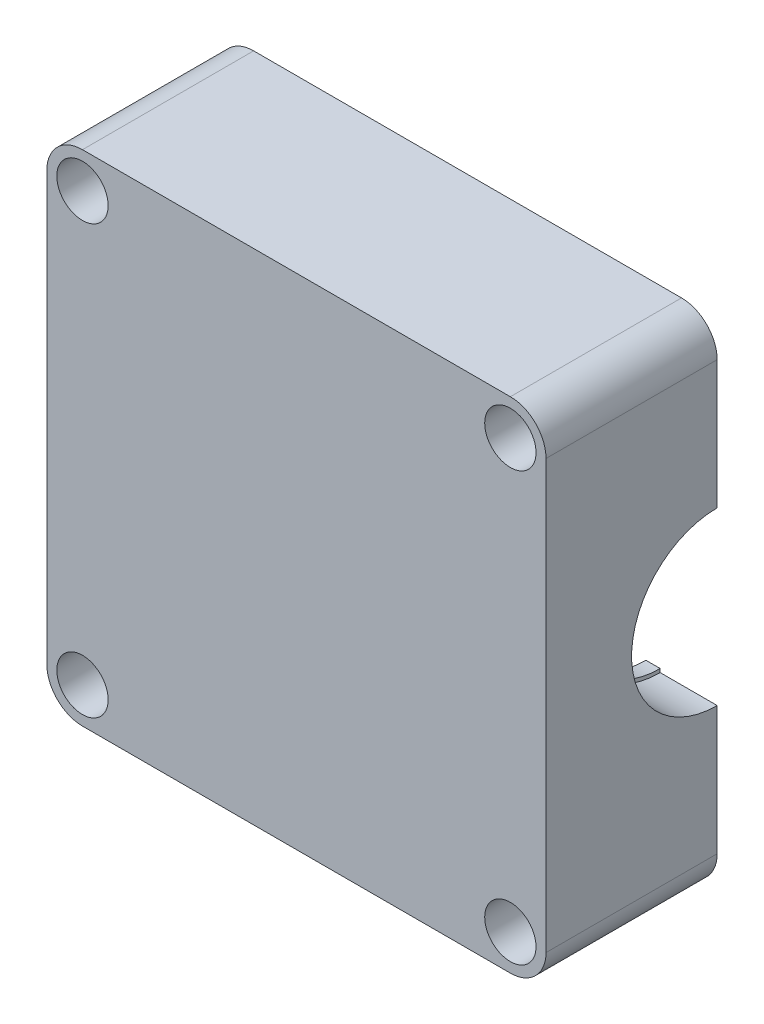
from build123d import *

# Parameters (mm, degrees)
SKETCH_1_R          = 1.8
EXTRUDE_1_DEPTH     = 42
SKETCH_2_R          = 6
CUT_EXTRUDE_1_DEPTH = 58.404268134
SKETCH_3_R          = 6
CUT_EXTRUDE_2_DEPTH = 58.404268134
CUT_EXTRUDE_3_DEPTH = 58.404268134
EXTRUDE_2_DEPTH     = 2.1
EXTRUDE_3_DEPTH     = 1
EXTRUDE_START       = -2
EXTRUDE_4_DEPTH     = 2


with BuildPart() as part:
    # 草图1 → 凸台-拉伸1 (new body)
    with BuildSketch(Plane(origin=(0, 0, 0), x_dir=(-1, 0, 0), z_dir=(0, 0, 1))):
        with BuildLine():
            Line((-17.5, 15), (-17.5, -15))
            ThreePointArc((-17.5, -15), (-16.767766953, -16.767766953), (-15, -17.5))
            Line((-15, -17.5), (15, -17.5))
            ThreePointArc((15, -17.5), (16.767766953, -16.767766953), (17.5, -15))
            Line((17.5, -15), (17.5, 15))
            ThreePointArc((17.5, 15), (16.767766953, 16.767766953), (15, 17.5))
            Line((15, 17.5), (-15, 17.5))
            ThreePointArc((-15, 17.5), (-16.767766953, 16.767766953), (-17.5, 15))
        make_face()
        with Locations((-15, -15)):
            Circle(SKETCH_1_R, mode=Mode.SUBTRACT)
        with Locations((15, -15)):
            Circle(SKETCH_1_R, mode=Mode.SUBTRACT)
        with Locations((15, 15)):
            Circle(SKETCH_1_R, mode=Mode.SUBTRACT)
        with Locations((-15, 15)):
            Circle(SKETCH_1_R, mode=Mode.SUBTRACT)
        with BuildLine():
            Line((15.604722414, -11.417049415), (15.604722414, 11.417049415))
            ThreePointArc((15.604722414, 11.417049415), (15.349600754, 12.084241863), (14.71440494, 12.410981979))
            ThreePointArc((14.71440494, 12.410981979), (13.158183899, 13.158182338), (12.410982221, 14.714402746))
            ThreePointArc((12.410982221, 14.714402746), (12.084242685, 15.349600017), (11.417049415, 15.604722414))
            Line((11.417049415, 15.604722414), (-11.417049415, 15.604722414))
            ThreePointArc((-11.417049415, 15.604722414), (-12.084241863, 15.349600754), (-12.410981979, 14.71440494))
            ThreePointArc((-12.410981979, 14.71440494), (-13.158182338, 13.158183899), (-14.714402746, 12.410982221))
            ThreePointArc((-14.714402746, 12.410982221), (-15.349600017, 12.084242685), (-15.604722413, 11.417049415))
            Line((-15.604722413, 11.417049415), (-15.604722413, -11.417049415))
            ThreePointArc((-15.604722413, -11.417049415), (-15.349600754, -12.084241863), (-14.71440494, -12.410981979))
            ThreePointArc((-14.71440494, -12.410981979), (-13.158183899, -13.158182338), (-12.410982221, -14.714402746))
            ThreePointArc((-12.410982221, -14.714402746), (-12.084242685, -15.349600017), (-11.417049415, -15.604722413))
            Line((-11.417049415, -15.604722413), (11.417049415, -15.604722413))
            ThreePointArc((11.417049415, -15.604722413), (12.084241863, -15.349600754), (12.410981979, -14.71440494))
            ThreePointArc((12.410981979, -14.71440494), (13.158182338, -13.158183899), (14.714402746, -12.410982221))
            ThreePointArc((14.714402746, -12.410982221), (15.349600017, -12.084242685), (15.604722414, -11.417049415))
        make_face(mode=Mode.SUBTRACT)
    extrude(amount=EXTRUDE_1_DEPTH)

    # 草图2 → 切除-拉伸1 (cut, through all)
    with BuildSketch(Plane(origin=(0, 17.5, 0), x_dir=(1, 0, 0), z_dir=(0, 1, 0))):
        with Locations(Location((0, -12, 0), (0, 0, 270))):
            Circle(SKETCH_2_R)
    extrude(amount=-CUT_EXTRUDE_1_DEPTH, mode=Mode.SUBTRACT)

    # 草图3 → 切除-拉伸2 (cut, through all)
    with BuildSketch(Plane.ZY.offset(17.5)):
        with Locations((30, 0)):
            Circle(SKETCH_3_R)
    extrude(amount=-CUT_EXTRUDE_2_DEPTH, mode=Mode.SUBTRACT)

    # 草图4 → 切除-拉伸3 (cut, through all)
    with BuildSketch(Plane(origin=(17.5, 0, 0), x_dir=(0, 0, -1), z_dir=(1, 0, 0))):
        Polygon((-30, 6), (-30, -18.57864904), (7.937077404, -18.57864904), (5.133649544, 19.10132203), (-30, 19.10132203), align=None)
    extrude(amount=-CUT_EXTRUDE_3_DEPTH, mode=Mode.SUBTRACT)

    # 草图5 → 凸台-拉伸2 (add)
    with BuildSketch(Plane(origin=(-15.604722414, 0, 0), x_dir=(0, 0, -1), z_dir=(1, 0, 0))):
        with BuildLine():
            Line((-30, -6.5), (-30, -6))
            ThreePointArc((-30, -6), (-36, 0), (-30, 6))
            Line((-30, 6), (-30, 6.5))
            ThreePointArc((-30, 6.5), (-36.5, 0), (-30, -6.5))
        make_face()
    extrude_2 = extrude(amount=EXTRUDE_2_DEPTH)

    # 草图6 → 凸台-拉伸3 (add)
    with BuildSketch(Plane(origin=(-13.504722414, 0, 0), x_dir=(0, 0, -1), z_dir=(1, 0, 0))):
        with BuildLine():
            Line((-30, -6.5), (-30, -5.75))
            ThreePointArc((-30, -5.75), (-35.75, 0), (-30, 5.75))
            Line((-30, 5.75), (-30, 6.5))
            ThreePointArc((-30, 6.5), (-36.5, 0), (-30, -6.5))
        make_face()
    extrude_3 = extrude(amount=EXTRUDE_3_DEPTH)

    # 镜向1: 凸台-拉伸2, 凸台-拉伸3 across plane
    add(extrude_2.mirror(Plane(origin=(0, 0, 0), x_dir=(0, 0, 1), z_dir=(1, 0, 0))))
    add(extrude_3.mirror(Plane(origin=(0, 0, 0), x_dir=(0, 0, 1), z_dir=(1, 0, 0))))

    # 草图7 → 凸台-拉伸4 (add)
    with BuildSketch(Plane.XY.offset(42).offset(EXTRUDE_START)):
        with BuildLine():
            Line((-15.604722414, 11.417049415), (-15.604722414, -11.417049415))
            ThreePointArc((-15.604722414, -11.417049415), (-15.349600754, -12.084241863), (-14.71440494, -12.410981979))
            ThreePointArc((-14.71440494, -12.410981979), (-13.158183899, -13.158182338), (-12.410982221, -14.714402746))
            ThreePointArc((-12.410982221, -14.714402746), (-12.084242685, -15.349600017), (-11.417049415, -15.604722414))
            Line((-11.417049415, -15.604722414), (11.417049415, -15.604722414))
            ThreePointArc((11.417049415, -15.604722414), (12.084241863, -15.349600754), (12.410981979, -14.71440494))
            ThreePointArc((12.410981979, -14.71440494), (13.158182338, -13.158183899), (14.714402746, -12.410982221))
            ThreePointArc((14.714402746, -12.410982221), (15.349600017, -12.084242685), (15.604722413, -11.417049415))
            Line((15.604722413, -11.417049415), (15.604722413, 11.417049415))
            ThreePointArc((15.604722413, 11.417049415), (15.349600754, 12.084241863), (14.71440494, 12.410981979))
            ThreePointArc((14.71440494, 12.410981979), (13.158183899, 13.158182338), (12.410982221, 14.714402746))
            ThreePointArc((12.410982221, 14.714402746), (12.084242685, 15.349600017), (11.417049415, 15.604722413))
            Line((11.417049415, 15.604722413), (-11.417049415, 15.604722413))
            ThreePointArc((-11.417049415, 15.604722413), (-12.084241863, 15.349600754), (-12.410981979, 14.71440494))
            ThreePointArc((-12.410981979, 14.71440494), (-13.158182338, 13.158183899), (-14.714402746, 12.410982221))
            ThreePointArc((-14.714402746, 12.410982221), (-15.349600017, 12.084242685), (-15.604722414, 11.417049415))
        make_face()
    extrude(amount=EXTRUDE_4_DEPTH)


solid = part.part
